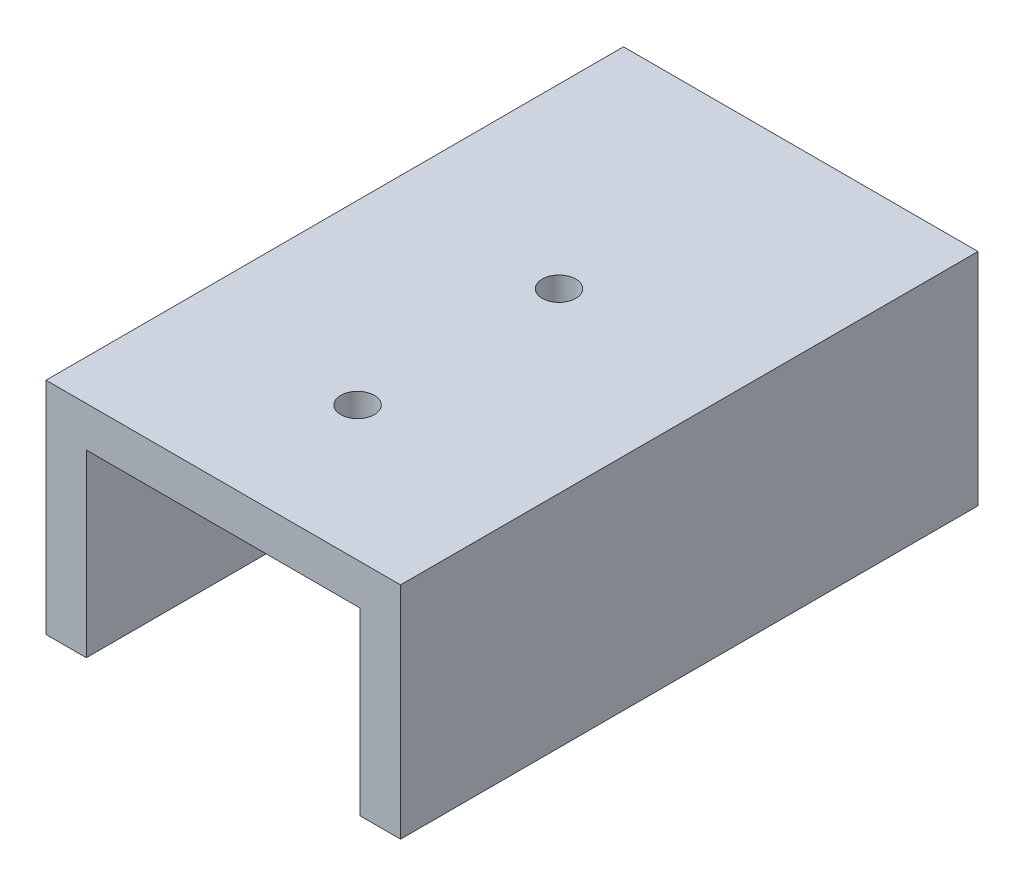
from build123d import *

# Parameters (mm, degrees)
SKETCH1_W           = 26.4
SKETCH1_H           = 26.4
SKETCH1_W_2         = 20.4
SKETCH1_H_2         = 20.4
BOSS_EXTRUDE1_DEPTH = 40
SKETCH2_W           = 26.4
SKETCH2_H           = 26.4
BOSS_EXTRUDE2_DEPTH = 3
SKETCH3_W           = 20.4
SKETCH3_H           = 40
CUT_EXTRUDE1_DEPTH  = 3
SKETCH4_R           = 1.25
CUT_EXTRUDE2_DEPTH  = 3
SKETCH5_W           = 26.4
SKETCH5_H           = 43
CUT_EXTRUDE3_DEPTH  = 10


with BuildPart() as part:
    # Sketch1 → Boss-Extrude1 (new body)
    with BuildSketch(Plane.XY):
        Rectangle(SKETCH1_W, SKETCH1_H)
        Rectangle(SKETCH1_W_2, SKETCH1_H_2, mode=Mode.SUBTRACT)
    extrude(amount=BOSS_EXTRUDE1_DEPTH)

    # Sketch2 → Boss-Extrude2 (add)
    with BuildSketch(Plane(origin=(0, 0, 0), x_dir=(-1, 0, 0), z_dir=(0, 0, -1))):
        Rectangle(SKETCH2_W, SKETCH2_H)
    extrude(amount=BOSS_EXTRUDE2_DEPTH)

    # Sketch3 → Cut-Extrude1 (cut)
    with BuildSketch(Plane.XZ.offset(13.2)):
        with Locations((0, 20)):
            Rectangle(SKETCH3_W, SKETCH3_H)
    extrude(amount=-CUT_EXTRUDE1_DEPTH, mode=Mode.SUBTRACT)

    # Sketch4 → Cut-Extrude2 (cut)
    with BuildSketch(Plane(origin=(0, 13.2, 0), x_dir=(1, 0, 0), z_dir=(0, 1, 0))):
        with Locations(Location((0, -15, 0), (0, 0, 270))):
            Circle(SKETCH4_R)
        with Locations(Location((0, -30, 0), (0, 0, 270))):
            Circle(SKETCH4_R)
    extrude(amount=-CUT_EXTRUDE2_DEPTH, mode=Mode.SUBTRACT)

    # Sketch5 → Cut-Extrude3 (cut)
    with BuildSketch(Plane.XZ.offset(13.2)):
        with Locations((0, 18.5)):
            Rectangle(SKETCH5_W, SKETCH5_H)
    extrude(amount=-CUT_EXTRUDE3_DEPTH, mode=Mode.SUBTRACT)


solid = part.part
